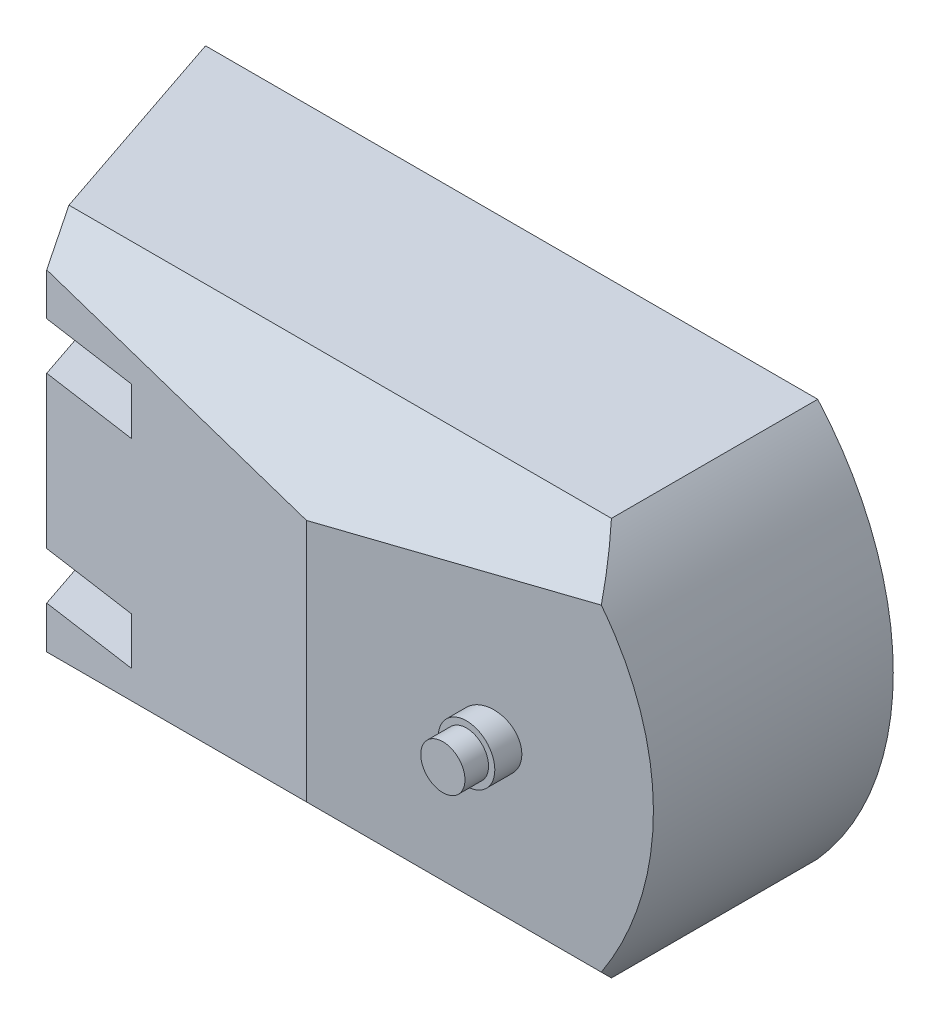
from build123d import *

# Parameters (mm, degrees)
BOSS_EXTRUDE1_DEPTH     = 3000
CUT_EXTRUDE1_DEPTH      = 25402.288510932
CUT_EXTRUDE1_DEPTH_BACK = 25402.288510932
CUT_EXTRUDE2_DEPTH      = 15914.769996038
CUT_EXTRUDE2_DEPTH_BACK = 15914.769996038
CUT_EXTRUDE3_START      = 3000
SKETCH4_W               = 1905
SKETCH4_H               = 500
CUT_EXTRUDE3_DEPTH      = 1500
SKETCH5_R               = 300
BOSS_EXTRUDE2_DEPTH     = 3000
SKETCH6_R               = 234
BOSS_EXTRUDE3_DEPTH     = 250
SKETCH7_R               = 63.5
CUT_EXTRUDE4_DEPTH      = 1750
SKETCH8_R               = 950
BOSS_EXTRUDE4_DEPTH     = 500


with BuildPart() as part:
    # Sketch1 → Boss-Extrude1 (new body)
    with BuildSketch(Plane.XY):
        with BuildLine():
            Line((-18658.550312437, 10876.722883323), (-25135.367216267, 10876.722883323))
            Line((-25135.367216267, 10876.722883323), (-25135.367216267, 15090.401997377))
            Line((-25135.367216267, 15090.401997377), (-18658.550312437, 15090.401997377))
            ThreePointArc((-18658.550312437, 15090.401997377), (-17858.808631219, 12983.56244035), (-18658.550312437, 10876.722883323))
        make_face()
    extrude(amount=BOSS_EXTRUDE1_DEPTH)

    # Sketch2 → Cut-Extrude1 (cut, two sides: drawn at the far end of the back side and taken through both)
    with BuildSketch(Plane(origin=(0, 12983.56244035, 0), x_dir=(1, 0, 0), z_dir=(0, 1, 0)).offset(-CUT_EXTRUDE1_DEPTH_BACK)):
        Polygon((-17858.808631219, -2538.97640876), (-21069.922216717, -3000), (-17858.808631219, -3000), align=None)
        Polygon((-24281.035802216, -2538.97640876), (-25139.206187576, 0), (-25135.367216266, -3000), (-21069.922216717, -3000), align=None)
    extrude(amount=CUT_EXTRUDE1_DEPTH + CUT_EXTRUDE1_DEPTH_BACK, mode=Mode.SUBTRACT)

    # Sketch3 → Cut-Extrude2 (cut, two sides: drawn at the far end of the back side and taken through both)
    with BuildSketch(Plane(origin=(-21069.922216718, 0, 0), x_dir=(0, 0, -1), z_dir=(1, 0, 0)).offset(-CUT_EXTRUDE2_DEPTH_BACK)):
        Polygon((-2183.733894313, 15090.401997377), (-3000, 14274.13589169), (-3000, 15090.401997377), align=None)
        Polygon((-3000, 11692.98898901), (-3000, 10876.722883323), (-2183.733894313, 10876.722883323), align=None)
    extrude(amount=CUT_EXTRUDE2_DEPTH + CUT_EXTRUDE2_DEPTH_BACK, mode=Mode.SUBTRACT)

    # Sketch4 → Cut-Extrude3 (cut)
    with BuildSketch(Plane.XY.offset(CUT_EXTRUDE3_START)):
        with Locations((-24182.867216267, 14036.982218863)):
            Rectangle(SKETCH4_W, SKETCH4_H)
        with Locations((-24182.867216267, 11930.142661836)):
            Rectangle(SKETCH4_W, SKETCH4_H)
    extrude(amount=-CUT_EXTRUDE3_DEPTH, mode=Mode.SUBTRACT)

    # Sketch5 → Boss-Extrude2 (add)
    with BuildSketch(Plane.XY):
        with Locations((-19376.758216718, 12983.56244035)):
            Circle(SKETCH5_R)
    extrude(amount=BOSS_EXTRUDE2_DEPTH)

    # Sketch6 → Boss-Extrude3 (add)
    with BuildSketch(Plane.XY.offset(3000)):
        with Locations((-19376.758216718, 12983.56244035)):
            Circle(SKETCH6_R)
    extrude(amount=BOSS_EXTRUDE3_DEPTH)

    # Sketch7 → Cut-Extrude4 (cut, symmetric)
    with BuildSketch(Plane(origin=(0, 12983.56244035, 0), x_dir=(-1, 0, 0), z_dir=(0, -1, 0))):
        with Locations(Location((23612.126841123, -2183.733894313, 0), (0, 0, 180))):
            Circle(SKETCH7_R)
    extrude(amount=CUT_EXTRUDE4_DEPTH, both=True, mode=Mode.SUBTRACT)

    # Sketch8 → Boss-Extrude4 (add)
    with BuildSketch(Plane(origin=(0, 0, 0), x_dir=(-1, 0, 0), z_dir=(0, 0, -1))):
        with Locations(Location((20757.187947729, 12983.56244035, 0), (0, 0, 180))):
            Circle(SKETCH8_R)
    extrude(amount=BOSS_EXTRUDE4_DEPTH)


solid = part.part
